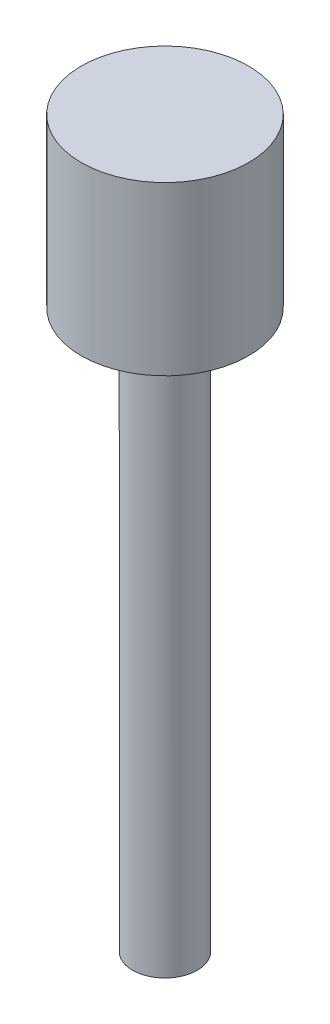
from build123d import *

# Parameters (mm, degrees)
SKETCH1_R           = 7.5
BOSS_EXTRUDE1_DEPTH = 15
SKETCH3_R           = 2.9
BOSS_EXTRUDE3_DEPTH = 50
SKETCH4_R           = 1.65
CUT_EXTRUDE1_DEPTH  = 12


with BuildPart() as part:
    # Sketch1 → Boss-Extrude1 (new body)
    with BuildSketch(Plane(origin=(0, 0, 0), x_dir=(1, 0, 0), z_dir=(0, 1, 0))):
        with Locations(Location((0, 0, 0), (0, 0, 270))):
            Circle(SKETCH1_R)
    extrude(amount=-BOSS_EXTRUDE1_DEPTH)

    # Sketch3 → Boss-Extrude3 (add)
    with BuildSketch(Plane.XZ.offset(15)):
        with Locations(Location((0, 0, 0), (0, 0, 90))):
            Circle(SKETCH3_R)
    extrude(amount=BOSS_EXTRUDE3_DEPTH)

    # Sketch4 → Cut-Extrude1 (cut)
    with BuildSketch(Plane(origin=(0, -65, 0), x_dir=(1, 0, 0), z_dir=(0, 1, 0))):
        with Locations(Location((0, 0, 0), (0, 0, 270))):
            Circle(SKETCH4_R)
    extrude(amount=CUT_EXTRUDE1_DEPTH, mode=Mode.SUBTRACT)


solid = part.part
